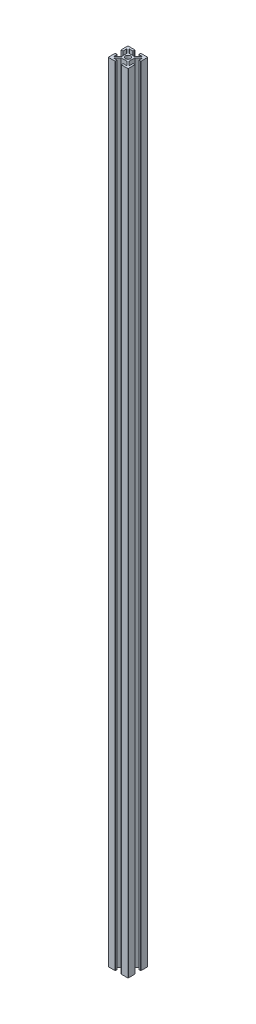
from build123d import *

# Parameters (mm, degrees)
SKETCH1_R           = 2.5
BOSS_EXTRUDE2_DEPTH = 800


with BuildPart() as part:
    # Sketch1 → Boss-Extrude2 (new body)
    with BuildSketch(Plane(origin=(0, 0, 0), x_dir=(1, 0, 0), z_dir=(0, 1, 0))):
        with BuildLine():
            Line((-9.896296296, 3), (-8.196296296, 3))
            ThreePointArc((-8.196296296, 3), (-8.090230279, 3.043933983), (-8.046296296, 3.15))
            Line((-8.046296296, 3.15), (-8.046296296, 6.586184513))
            ThreePointArc((-8.046296296, 6.586184513), (-7.954097251, 6.724600732), (-7.790842301, 6.692859041))
            Line((-7.790842301, 6.692859041), (-4, 2.945390222))
            Line((-4, 2.945390222), (-4, -2.945390222))
            Line((-4, -2.945390222), (-7.790842301, -6.692859041))
            ThreePointArc((-7.790842301, -6.692859041), (-7.954097251, -6.724600732), (-8.046296296, -6.586184513))
            Line((-8.046296296, -6.586184513), (-8.046296296, -3.15))
            ThreePointArc((-8.046296296, -3.15), (-8.090230279, -3.043933983), (-8.196296296, -3))
            Line((-8.196296296, -3), (-9.896296296, -3))
            ThreePointArc((-9.896296296, -3), (-10.002362313, -3.043933983), (-10.046296296, -3.15))
            Line((-10.046296296, -3.15), (-10.046296296, -9.65))
            ThreePointArc((-10.046296296, -9.65), (-9.94378367, -9.897487373), (-9.696296296, -10))
            Line((-9.696296296, -10), (-3.196296296, -10))
            ThreePointArc((-3.196296296, -10), (-3.090230279, -9.956066017), (-3.046296296, -9.85))
            Line((-3.046296296, -9.85), (-3.046296296, -8.15))
            ThreePointArc((-3.046296296, -8.15), (-3.090230279, -8.043933983), (-3.196296296, -8))
            Line((-3.196296296, -8), (-6.614381093, -8))
            ThreePointArc((-6.614381093, -8), (-6.753127587, -7.9070036), (-6.719835089, -7.743325472))
            Line((-6.719835089, -7.743325472), (-2.93318409, -4))
            Line((-2.93318409, -4), (2.93318409, -4))
            Line((2.93318409, -4), (6.719835089, -7.743325472))
            ThreePointArc((6.719835089, -7.743325472), (6.753127587, -7.9070036), (6.614381093, -8))
            Line((6.614381093, -8), (3.196296296, -8))
            ThreePointArc((3.196296296, -8), (3.090230279, -8.043933983), (3.046296296, -8.15))
            Line((3.046296296, -8.15), (3.046296296, -9.85))
            ThreePointArc((3.046296296, -9.85), (3.090230279, -9.956066017), (3.196296296, -10))
            Line((3.196296296, -10), (9.696296296, -10))
            ThreePointArc((9.696296296, -10), (9.94378367, -9.897487373), (10.046296296, -9.65))
            Line((10.046296296, -9.65), (10.046296296, -3.15))
            ThreePointArc((10.046296296, -3.15), (10.002362313, -3.043933983), (9.896296296, -3))
            Line((9.896296296, -3), (8.196296296, -3))
            ThreePointArc((8.196296296, -3), (8.090230279, -3.043933983), (8.046296296, -3.15))
            Line((8.046296296, -3.15), (8.046296296, -6.586184513))
            ThreePointArc((8.046296296, -6.586184513), (7.954097251, -6.724600732), (7.790842301, -6.692859041))
            Line((7.790842301, -6.692859041), (4, -2.945390222))
            Line((4, -2.945390222), (4, 2.945390222))
            Line((4, 2.945390222), (7.790842301, 6.692859041))
            ThreePointArc((7.790842301, 6.692859041), (7.954097251, 6.724600732), (8.046296296, 6.586184513))
            Line((8.046296296, 6.586184513), (8.046296296, 3.15))
            ThreePointArc((8.046296296, 3.15), (8.090230279, 3.043933983), (8.196296296, 3))
            Line((8.196296296, 3), (9.896296296, 3))
            ThreePointArc((9.896296296, 3), (10.002362313, 3.043933983), (10.046296296, 3.15))
            Line((10.046296296, 3.15), (10.046296296, 9.65))
            ThreePointArc((10.046296296, 9.65), (9.94378367, 9.897487373), (9.696296296, 10))
            Line((9.696296296, 10), (3.196296296, 10))
            ThreePointArc((3.196296296, 10), (3.090230279, 9.956066017), (3.046296296, 9.85))
            Line((3.046296296, 9.85), (3.046296296, 8.15))
            ThreePointArc((3.046296296, 8.15), (3.090230279, 8.043933983), (3.196296296, 8))
            Line((3.196296296, 8), (6.614381093, 8))
            ThreePointArc((6.614381093, 8), (6.753127587, 7.9070036), (6.719835089, 7.743325472))
            Line((6.719835089, 7.743325472), (2.93318409, 4))
            Line((2.93318409, 4), (-2.93318409, 4))
            Line((-2.93318409, 4), (-6.719835089, 7.743325472))
            ThreePointArc((-6.719835089, 7.743325472), (-6.753127587, 7.9070036), (-6.614381093, 8))
            Line((-6.614381093, 8), (-3.196296296, 8))
            ThreePointArc((-3.196296296, 8), (-3.090230279, 8.043933983), (-3.046296296, 8.15))
            Line((-3.046296296, 8.15), (-3.046296296, 9.85))
            ThreePointArc((-3.046296296, 9.85), (-3.090230279, 9.956066017), (-3.196296296, 10))
            Line((-3.196296296, 10), (-9.696296296, 10))
            ThreePointArc((-9.696296296, 10), (-9.94378367, 9.897487373), (-10.046296296, 9.65))
            Line((-10.046296296, 9.65), (-10.046296296, 3.15))
            ThreePointArc((-10.046296296, 3.15), (-10.002362313, 3.043933983), (-9.896296296, 3))
        make_face()
        with Locations(Location((0, 0, 0), (0, 0, 270))):
            Circle(SKETCH1_R, mode=Mode.SUBTRACT)
    extrude(amount=BOSS_EXTRUDE2_DEPTH)


solid = part.part
